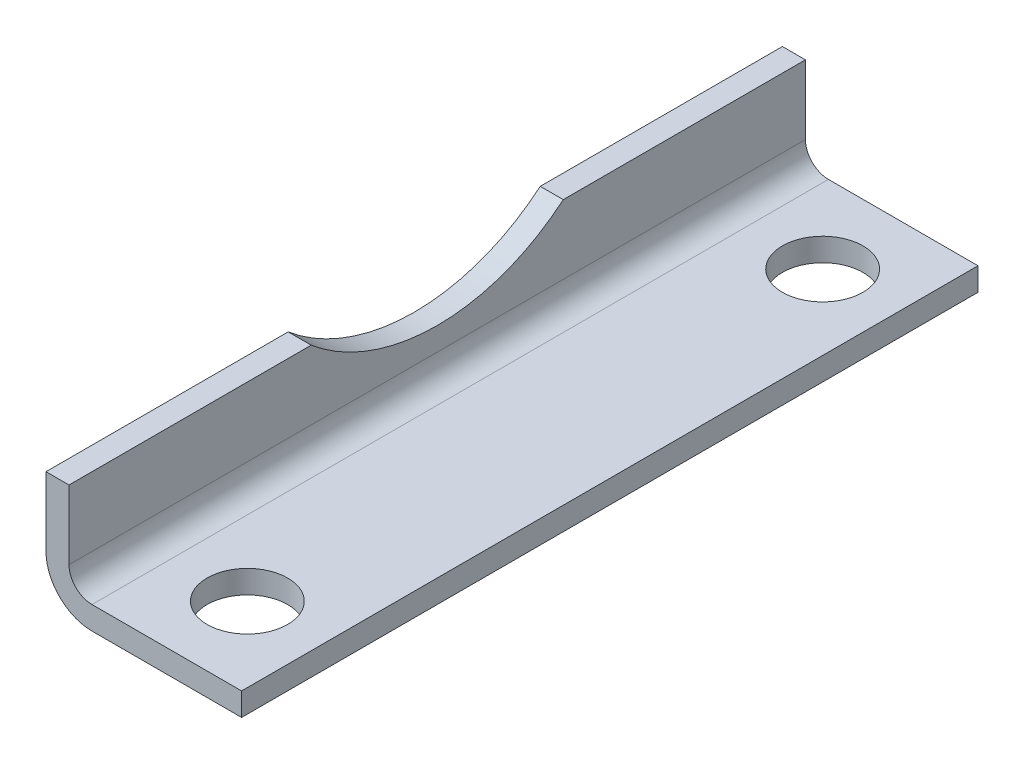
from build123d import *

# Parameters (mm, degrees)
EXTRUDE_1_DEPTH     = 32
FILLET_1_R          = 4
FILLET_2_R          = 2
SKETCH_2_R          = 3.5
CUT_EXTRUDE_1_DEPTH = 10
SKETCH_3_R          = 17
CUT_EXTRUDE_2_DEPTH = 10


with BuildPart() as part:
    # 草图1 → 凸台-拉伸1 (new, symmetric)
    with BuildSketch(Plane.XY):
        Polygon((0, 0), (0, 10), (2, 10), (2, 2), (17, 2), (17, 0), align=None)
    extrude(amount=EXTRUDE_1_DEPTH, both=True)

    # 圆角1
    fillet_1_edges = [part.edges().sort_by_distance(p)[0] for p in [
        (0, 0, 0),
    ]]
    fillet(fillet_1_edges, radius=FILLET_1_R)

    # 圆角2
    fillet_2_edges = [part.edges().sort_by_distance(p)[0] for p in [
        (2, 2, 0),
    ]]
    fillet(fillet_2_edges, radius=FILLET_2_R)

    # 草图2 → 切除-拉伸1 (cut)
    with BuildSketch(Plane.XZ):
        with Locations(Location((10.5, 25, 0), (0, 0, 270))):
            Circle(SKETCH_2_R)
        with Locations((10.5, -25)):
            Circle(SKETCH_2_R)
    extrude(amount=-CUT_EXTRUDE_1_DEPTH, mode=Mode.SUBTRACT)

    # 草图3 → 切除-拉伸2 (cut)
    with BuildSketch(Plane.ZY):
        with Locations((0, 23)):
            Circle(SKETCH_3_R)
    extrude(amount=-CUT_EXTRUDE_2_DEPTH, mode=Mode.SUBTRACT)


solid = part.part
